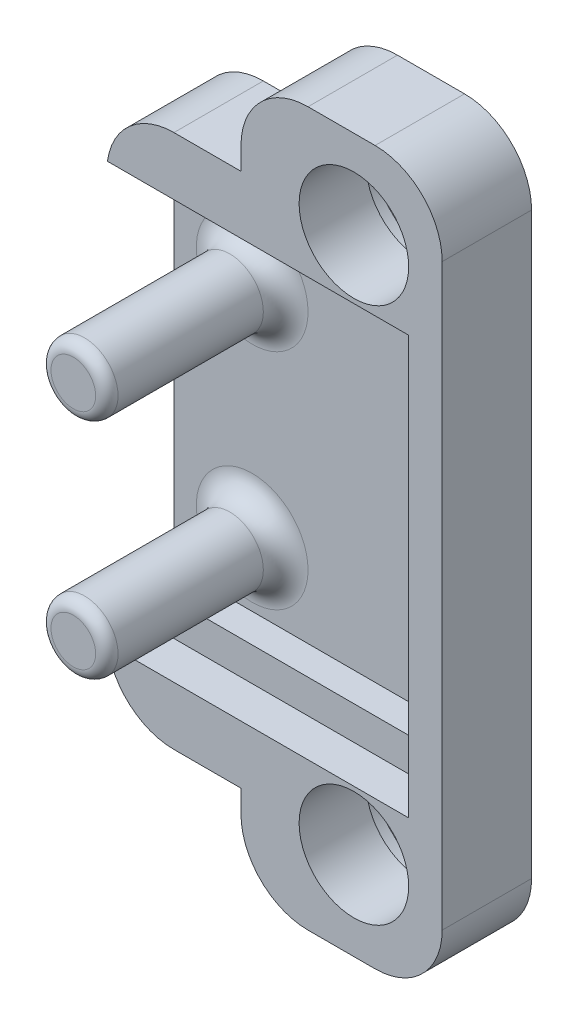
from build123d import *

# Parameters (mm, degrees)
SKETCH1_W           = 20.480821918
SKETCH1_H           = 31.9
SKETCH1_R           = 2.45
BOSS_EXTRUDE1_DEPTH = 4
SKETCH2_W           = 18.980821918
SKETCH2_H           = 9.35
CUT_EXTRUDE1_DEPTH  = 3
SKETCH3_R           = 1.5
BOSS_EXTRUDE2_DEPTH = 8
SKETCH4_W           = 18.980821918
SKETCH4_H           = 1.5
BOSS_EXTRUDE3_DEPTH = 1.3
SKETCH5_W           = 5.480821918
SKETCH5_H           = 31.9
CUT_EXTRUDE2_DEPTH  = 7.4
SKETCH6_W           = 6
SKETCH6_H           = 4
CUT_EXTRUDE3_DEPTH  = 4
FILLET1_R           = 3
FILLET2_R           = 1
FILLET3_R           = 0.5
SKETCH7_R           = 3.25
CUT_EXTRUDE4_DEPTH  = 1


with BuildPart() as part:
    # Sketch1 → Boss-Extrude1 (new body)
    with BuildSketch(Plane.XY):
        Rectangle(SKETCH1_W, SKETCH1_H)
        with Locations((6.290410959, 12)):
            Circle(SKETCH1_R, mode=Mode.SUBTRACT)
        with Locations((6.290410959, -12)):
            Circle(SKETCH1_R, mode=Mode.SUBTRACT)
    extrude(amount=BOSS_EXTRUDE1_DEPTH)

    # Sketch2 → Cut-Extrude1 (cut)
    with BuildSketch(Plane.XY.offset(4)):
        with Locations((-0.75, 4.675)):
            Rectangle(SKETCH2_W, SKETCH2_H)
        with Locations((-0.75, -4.675)):
            Rectangle(SKETCH2_W, SKETCH2_H)
    extrude(amount=-CUT_EXTRUDE1_DEPTH, mode=Mode.SUBTRACT)

    # Sketch3 → Boss-Extrude2 (add)
    with BuildSketch(Plane.XY.offset(1)):
        with Locations((-1.259589041, 5)):
            Circle(SKETCH3_R)
        with Locations((-1.259589041, -5)):
            Circle(SKETCH3_R)
    extrude(amount=BOSS_EXTRUDE2_DEPTH)

    # Sketch4 → Boss-Extrude3 (add)
    with BuildSketch(Plane.XY.offset(1)):
        with Locations((-0.75, 8.6)):
            Rectangle(SKETCH4_W, SKETCH4_H)
        with Locations((-0.75, -8.6)):
            Rectangle(SKETCH4_W, SKETCH4_H)
    extrude(amount=BOSS_EXTRUDE3_DEPTH)

    # Sketch5 → Cut-Extrude2 (cut)
    with BuildSketch(Plane.XY.offset(4)):
        with Locations((-7.5, 0)):
            Rectangle(SKETCH5_W, SKETCH5_H)
    extrude(amount=-CUT_EXTRUDE2_DEPTH, mode=Mode.SUBTRACT)

    # Sketch6 → Cut-Extrude3 (cut)
    with BuildSketch(Plane.XY.offset(4)):
        with Locations((-1.759589041, 13.95)):
            Rectangle(SKETCH6_W, SKETCH6_H)
        with Locations((-1.759589041, -13.95)):
            Rectangle(SKETCH6_W, SKETCH6_H)
    extrude(amount=-CUT_EXTRUDE3_DEPTH, mode=Mode.SUBTRACT)

    # Fillet1
    fillet1_edges = [part.edges().sort_by_distance(p)[0] for p in [
        (10.240410959, 15.95, 2),
        (10.240410959, -15.95, 2),
        (1.240410959, -15.95, 2),
        (-4.759589041, -11.95, 2),
        (-4.759589041, 11.95, 2),
        (1.240410959, 15.95, 2),
    ]]
    fillet(fillet1_edges, radius=FILLET1_R)

    # Fillet2
    fillet2_edges = [part.edges().sort_by_distance(p)[0] for p in [
        (-2.759589041, 5, 1),
        (-2.759589041, -5, 1),
    ]]
    fillet(fillet2_edges, radius=FILLET2_R)

    # Fillet3
    fillet3_edges = [part.edges().sort_by_distance(p)[0] for p in [
        (-2.759589041, 5, 9),
        (-2.759589041, -5, 9),
    ]]
    fillet(fillet3_edges, radius=FILLET3_R)

    # Sketch7 → Cut-Extrude4 (cut)
    with BuildSketch(Plane(origin=(0, 0, 0), x_dir=(-1, 0, 0), z_dir=(0, 0, -1))):
        with Locations((-6.290410959, 12)):
            Circle(SKETCH7_R)
        with Locations((-6.290410959, -12)):
            Circle(SKETCH7_R)
    extrude(amount=-CUT_EXTRUDE4_DEPTH, mode=Mode.SUBTRACT)


solid = part.part
